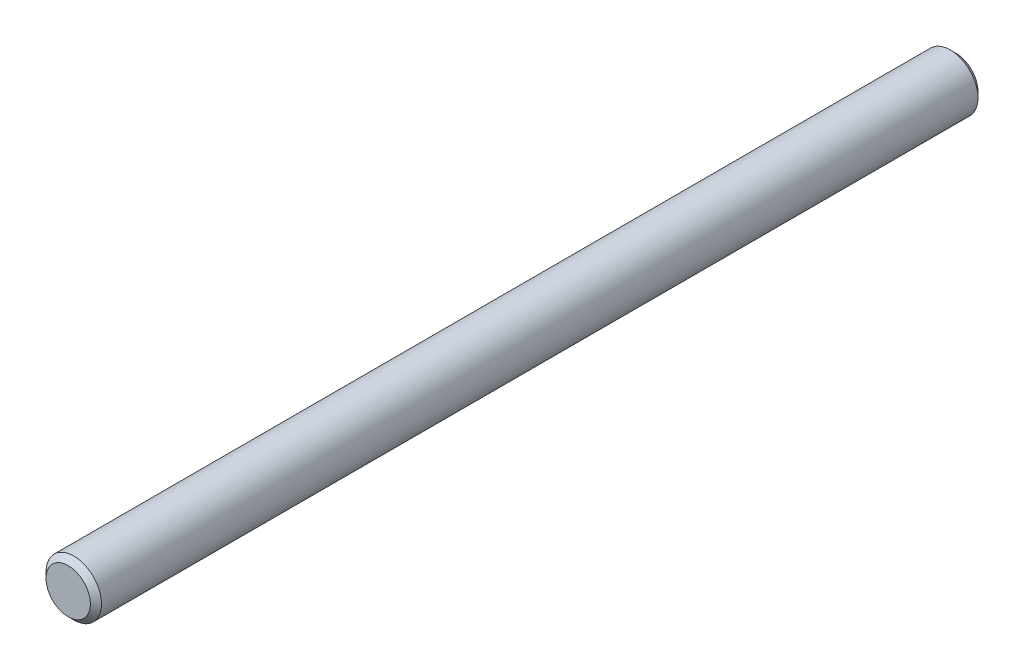
from build123d import *


with BuildPart() as part:
    # Sketch1 → Revolve1 (revolve)
    with BuildSketch(Plane(origin=(0, 0, 0), x_dir=(1, 0, 0), z_dir=(0, 1, 0))):
        Polygon((2, 20), (0, 20), (0, -60), (2, -60), (2.5, -59.5), (2.5, 19.5), align=None)
    revolve(axis=Axis((0, 0, -20), (0, 0, 1)))


solid = part.part
